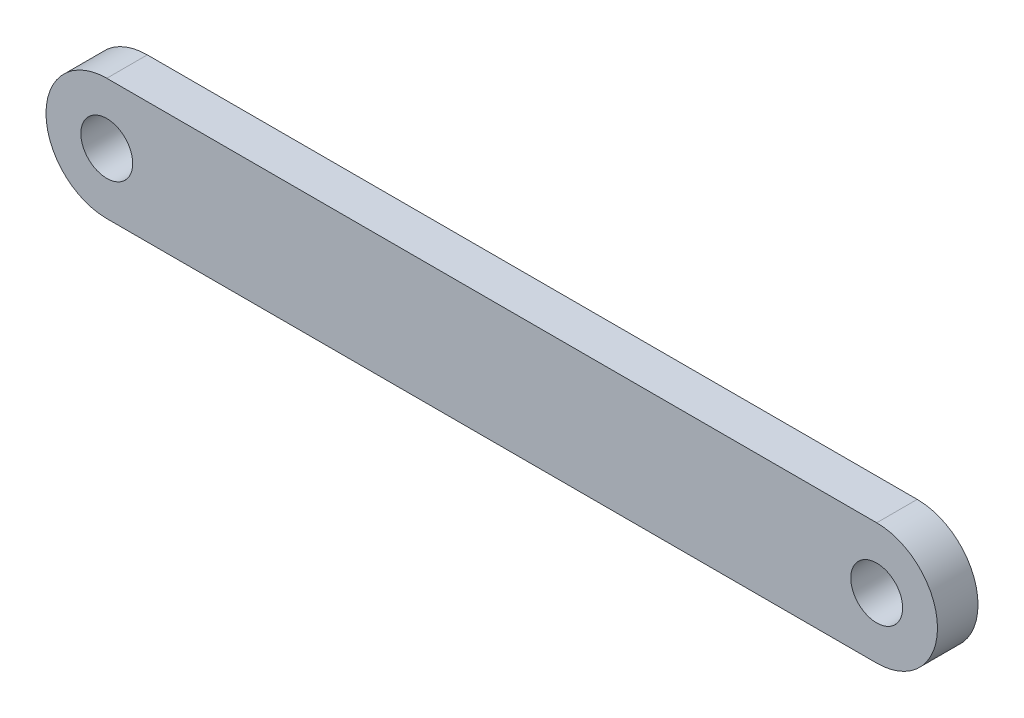
from build123d import *

# Parameters (mm, degrees)
SKETCH1_R           = 2.032
BOSS_EXTRUDE1_DEPTH = 3.175


with BuildPart() as part:
    # Sketch1 → Boss-Extrude1 (new body)
    with BuildSketch(Plane.XY):
        with BuildLine():
            Line((0, 4.7625), (60.325, 4.7625))
            ThreePointArc((60.325, 4.7625), (65.0875, 0), (60.325, -4.7625))
            Line((60.325, -4.7625), (0, -4.7625))
            ThreePointArc((0, -4.7625), (-4.7625, 0), (0, 4.7625))
        make_face()
        Circle(SKETCH1_R, mode=Mode.SUBTRACT)
        with Locations((60.325, 0)):
            Circle(SKETCH1_R, mode=Mode.SUBTRACT)
    extrude(amount=BOSS_EXTRUDE1_DEPTH)


solid = part.part
